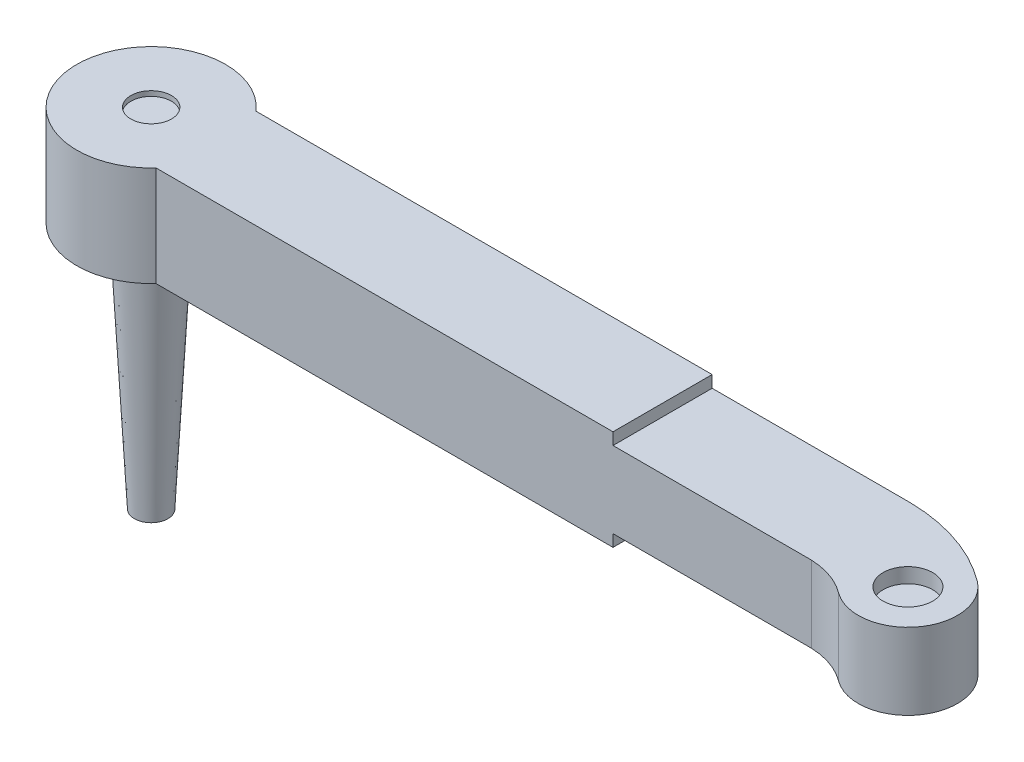
from build123d import *

# Parameters (mm, degrees)
SALIENTE_EXTRUIR1_DEPTH = 10.1
CROQUIS7_R              = 2.05
CORTAR_EXTRUIR1_DEPTH   = 0.5
CROQUIS11_W             = 20
CROQUIS11_H             = 1.2
CORTAR_EXTRUIR4_DEPTH   = 49.847437401
SALIENTE_EXTRUIR4_START = -7.7
SALIENTE_EXTRUIR4_DEPTH = 7.7
CROQUIS13_R             = 2.5
CORTAR_EXTRUIR5_DEPTH   = 1.5
CROQUIS14_R             = 3
SALIENTE_EXTRUIR5_DEPTH = 25
SALIENTE_EXTRUIR5_TAPER = 3


with BuildPart() as part:
    # Croquis1 → Saliente-Extruir1 (new body)
    with BuildSketch(Plane(origin=(0, 0, 0), x_dir=(1, 0, 0), z_dir=(0, 1, 0))):
        with BuildLine():
            Line((-33.071856209, -5.003625594), (33.023928918, -5.003625594))
            Line((33.023928918, -5.003625594), (33.023928918, 4.996374406))
            Line((33.023928918, 4.996374406), (-32.976071082, 4.996374406))
            ThreePointArc((-32.976071082, 4.996374406), (-46.113327984, 0.121751049), (-33.071856209, -5.003625594))
        make_face()
    extrude(amount=SALIENTE_EXTRUIR1_DEPTH)

    # Croquis7 → Cortar-Extruir1 (cut)
    with BuildSketch(Plane(origin=(0, 10.1, 0), x_dir=(1, 0, 0), z_dir=(0, 1, 0))):
        with Locations(Location((-38.613672015, 0.049915499, 0), (0, 0, 270))):
            Circle(CROQUIS7_R)
    extrude(amount=-CORTAR_EXTRUIR1_DEPTH, mode=Mode.SUBTRACT)

    # Croquis11 → Cortar-Extruir4 (cut, through all)
    with BuildSketch(Plane.XY.offset(5.003625594)):
        with Locations((23.023928918, 9.5)):
            Rectangle(CROQUIS11_W, CROQUIS11_H)
        with Locations((23.023928918, 0.6)):
            Rectangle(CROQUIS11_W, CROQUIS11_H)
    extrude(amount=-CORTAR_EXTRUIR4_DEPTH, mode=Mode.SUBTRACT)

    # Croquis12 → Saliente-Extruir4 (add)
    with BuildSketch(Plane(origin=(0, 8.9, 0), x_dir=(1, 0, 0), z_dir=(0, 1, 0)).offset(SALIENTE_EXTRUIR4_START)):
        with BuildLine():
            Line((33.023928918, 4.996374406), (33.023928918, -5.003625594))
            ThreePointArc((33.023928918, -5.003625594), (35.299630193, -5.437603932), (37.334427549, -6.54519285))
            ThreePointArc((37.334427549, -6.54519285), (44.24999745, -5.462503991), (43.306208076, 1.473387001))
            ThreePointArc((43.306208076, 1.473387001), (38.445512688, 4.053392135), (33.023928918, 4.996374406))
        make_face()
    extrude(amount=SALIENTE_EXTRUIR4_DEPTH)

    # Croquis13 → Cortar-Extruir5 (cut)
    with BuildSketch(Plane(origin=(0, 8.9, 0), x_dir=(1, 0, 0), z_dir=(0, 1, 0))):
        with Locations(Location((40.239901123, -2.476013165, 0), (0, 0, 270))):
            Circle(CROQUIS13_R)
    cortar_extruir5 = extrude(amount=-CORTAR_EXTRUIR5_DEPTH, mode=Mode.SUBTRACT)

    # Croquis14 → Saliente-Extruir5 (add)
    with BuildSketch(Plane.XZ):
        with Locations((-38.613672015, -0.049915499)):
            Circle(CROQUIS14_R)
    extrude(amount=SALIENTE_EXTRUIR5_DEPTH, taper=SALIENTE_EXTRUIR5_TAPER)

    # Simetría1: Cortar-Extruir5 across plane
    add(cortar_extruir5.mirror(Plane.ZX.offset(5.05)), mode=Mode.SUBTRACT)


solid = part.part
